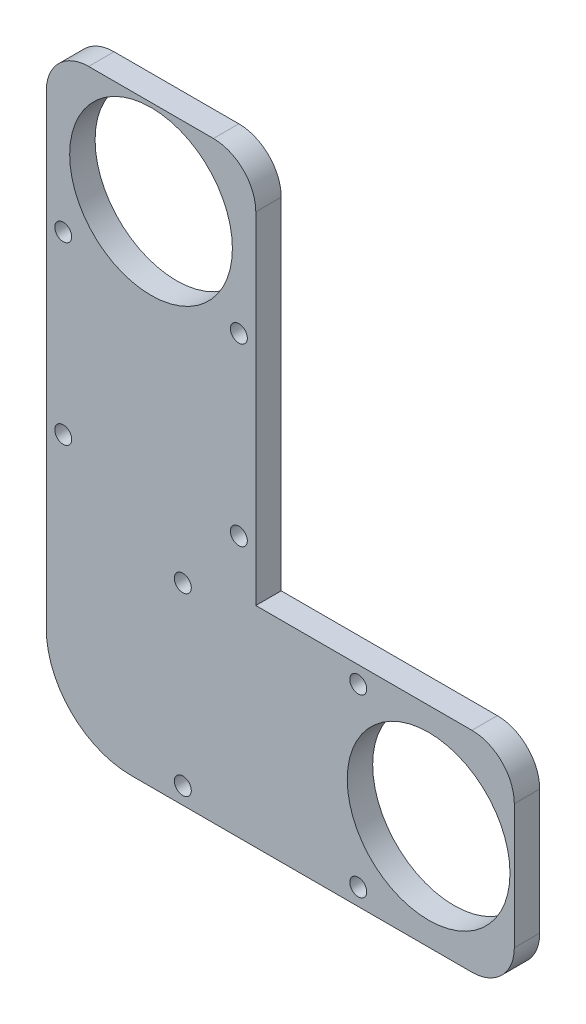
from build123d import *

# Parameters (mm, degrees)
SKETCH_1_W          = 45.22
SKETCH_1_H          = 24.72
SKETCH_1_R          = 9.6
SKETCH_1_R_2        = 1
EXTRUDE_1_DEPTH     = 3
SKETCH_2_W          = 3
SKETCH_2_H          = 24.72
EXTRUDE_2_DEPTH     = 10
SKETCH_3_W          = 24.72
SKETCH_3_H          = 3
EXTRUDE_3_DEPTH     = 45.22
SKETCH_4_R          = 9.6
SKETCH_4_R_2        = 1
CUT_EXTRUDE_1_DEPTH = 4
FILLET_3_R          = 10
FILLET_4_R          = 5
FILLET_5_R          = 5
FILLET_6_R          = 5
FILLET_7_R          = 5


with BuildPart() as part:
    # 草图1 → 凸台-拉伸1 (new body)
    with BuildSketch(Plane.XY):
        with Locations((21.400674487, -11.617565982)):
            Rectangle(SKETCH_1_W, SKETCH_1_H)
        with Locations((33.900674487, -11.617565982)):
            Circle(SKETCH_1_R, mode=Mode.SUBTRACT)
        with Locations((25.600674487, -1.257565982)):
            Circle(SKETCH_1_R_2, mode=Mode.SUBTRACT)
        with Locations((4.900674487, -1.257565982)):
            Circle(SKETCH_1_R_2, mode=Mode.SUBTRACT)
        with Locations((4.900674487, -21.977565982)):
            Circle(SKETCH_1_R_2, mode=Mode.SUBTRACT)
        with Locations((25.600674487, -21.977565982)):
            Circle(SKETCH_1_R_2, mode=Mode.SUBTRACT)
    extrude(amount=EXTRUDE_1_DEPTH)

    # 草图2 → 凸台-拉伸2 (add)
    with BuildSketch(Plane.ZY.offset(1.209325513)):
        with Locations((1.5, -11.617565982)):
            Rectangle(SKETCH_2_W, SKETCH_2_H)
    extrude(amount=EXTRUDE_2_DEPTH)

    # 草图3 → 凸台-拉伸3 (add)
    with BuildSketch(Plane(origin=(0, 0.742434018, 0), x_dir=(1, 0, 0), z_dir=(0, 1, 0))):
        with Locations((1.150674487, -1.5)):
            Rectangle(SKETCH_3_W, SKETCH_3_H)
    extrude(amount=EXTRUDE_3_DEPTH)

    # 草图4 → 切除-拉伸1 (cut)
    with BuildSketch(Plane.XY.offset(3)):
        with Locations((1.150674487, 35.852434018)):
            Circle(SKETCH_4_R)
        with Locations((-9.209325513, 27.552434018)):
            Circle(SKETCH_4_R_2)
        with Locations((11.510674487, 27.552434018)):
            Circle(SKETCH_4_R_2)
        with Locations((11.510674487, 6.852434018)):
            Circle(SKETCH_4_R_2)
        with Locations((-9.209325513, 6.852434018)):
            Circle(SKETCH_4_R_2)
    extrude(amount=-CUT_EXTRUDE_1_DEPTH, mode=Mode.SUBTRACT)

    # 圆角3
    fillet_3_edges = [part.edges().sort_by_distance(p)[0] for p in [
        (-11.209325513, -23.977565982, 1.5),
    ]]
    fillet(fillet_3_edges, radius=FILLET_3_R)

    # 圆角4
    fillet_4_edges = [part.edges().sort_by_distance(p)[0] for p in [
        (44.010674487, -23.977565982, 1.5),
    ]]
    fillet(fillet_4_edges, radius=FILLET_4_R)

    # 圆角5
    fillet_5_edges = [part.edges().sort_by_distance(p)[0] for p in [
        (44.010674487, 0.742434018, 1.5),
    ]]
    fillet(fillet_5_edges, radius=FILLET_5_R)

    # 圆角6
    fillet_6_edges = [part.edges().sort_by_distance(p)[0] for p in [
        (-11.209325513, 45.962434018, 1.5),
    ]]
    fillet(fillet_6_edges, radius=FILLET_6_R)

    # 圆角7
    fillet_7_edges = [part.edges().sort_by_distance(p)[0] for p in [
        (13.510674487, 45.962434018, 1.5),
    ]]
    fillet(fillet_7_edges, radius=FILLET_7_R)


solid = part.part
